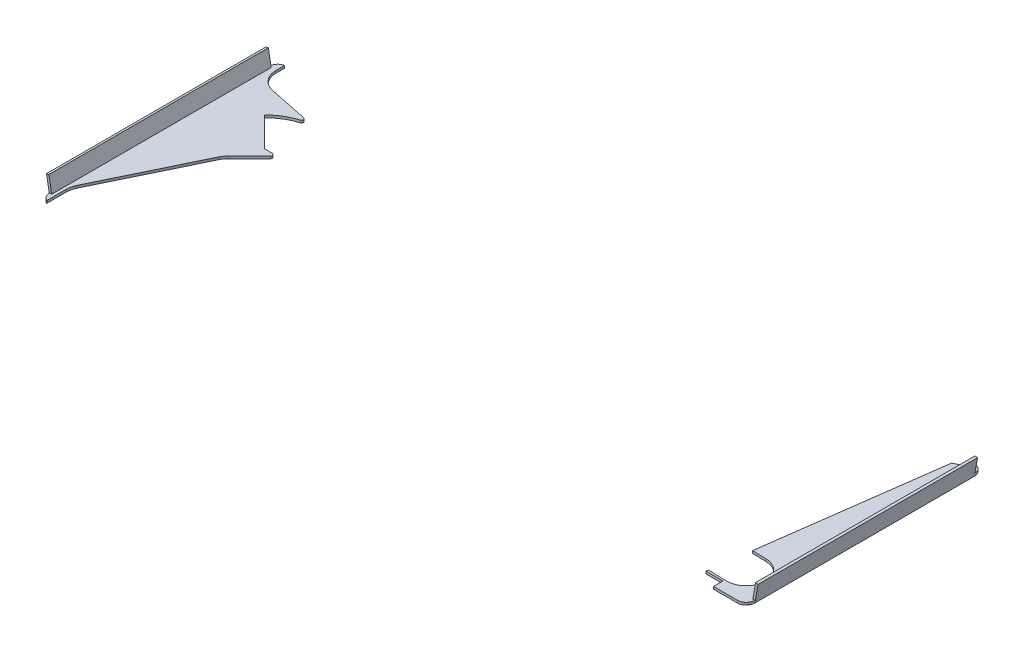
from build123d import *

# Parameters (mm, degrees)
BOSS_EXTRUDE1_DEPTH   = 6.35
BOSS_EXTRUDE1_2_DEPTH = 6.35
SKETCH2_W             = 571.5
SKETCH2_H             = 46.788217492
BOSS_EXTRUDE2_DEPTH   = 6.35
SKETCH3_W             = 571.5
SKETCH3_H             = 46.788217492
BOSS_EXTRUDE3_DEPTH   = 6.35


with BuildPart() as part:
    # Sketch1 → Boss-Extrude1 (new body)
    with BuildSketch(Plane(origin=(0, 0, 0), x_dir=(1, 0, 0), z_dir=(0, 1, 0))):
        with BuildLine():
            Line((918.085858671, -285.75), (918.085858671, 285.75))
            ThreePointArc((918.085858671, 285.75), (911.426679842, 301.826679842), (895.35, 308.485858671))
            Line((895.35, 308.485858671), (885.19, 308.485858671))
            Line((885.19, 308.485858671), (885.19, 289.56))
            Line((885.19, 289.56), (864.87, 279.4))
            Line((864.87, 279.4), (803.148852568, -176.858594457))
            Line((803.148852568, -176.858594457), (839.587388975, -177.854835662))
            ThreePointArc((839.587388975, -177.854835662), (888.945151826, -229.987846529), (836.811695918, -279.34513931))
            Line((836.811695918, -279.34513931), (789.460059122, -278.049675912))
            Line((789.460059122, -278.049675912), (788.67, -283.889996122))
            Line((788.67, -283.889996122), (833.12, -283.889996122))
            Line((833.12, -283.889996122), (833.12, -308.485858671))
            Line((833.12, -308.485858671), (895.35, -308.485858671))
            ThreePointArc((895.35, -308.485858671), (911.426679842, -301.826679842), (918.085858671, -285.75))
        make_face()
    extrude(amount=BOSS_EXTRUDE1_DEPTH)

    # Sketch3 → Boss-Extrude3 (add)
    with BuildSketch(Plane(origin=(890.402182656, -157.001928484, 0), x_dir=(0, 0, 1), z_dir=(-0.9848077530122081, 0.17364817766693072, 0))):
        with Locations((0, 182.818045046)):
            Rectangle(SKETCH3_W, SKETCH3_H)
    extrude(amount=BOSS_EXTRUDE3_DEPTH)


with BuildPart() as body_2:
    # Sketch1 → Boss-Extrude1 2 (new body)
    with BuildSketch(Plane(origin=(0, 0, 0), x_dir=(1, 0, 0), z_dir=(0, 1, 0))):
        with BuildLine():
            Line((-918.085858671, 285.75), (-918.085858671, -285.75))
            ThreePointArc((-918.085858671, -285.75), (-914.511728847, -297.987132715), (-904.913062406, -306.376854024))
            Line((-904.913062406, -306.376854024), (-904.913062406, -255.27))
            ThreePointArc((-904.913062406, -255.27), (-903.629350189, -243.921993823), (-899.843092163, -233.147514188))
            Line((-899.843092163, -233.147514188), (-779.193092163, 16.251587569))
            ThreePointArc((-779.193092163, 16.251587569), (-774.867453261, 23.562355365), (-769.384086891, 30.050126241))
            Line((-769.384086891, 30.050126241), (-714.14942221, 85.284790922))
            ThreePointArc((-714.14942221, 85.284790922), (-713.065558454, 90.733741989), (-717.684956116, 93.820324827))
            Line((-717.684956116, 93.820324827), (-737.683726269, 93.820324827))
            Line((-737.683726269, 93.820324827), (-813.980179417, 170.116777976))
            ThreePointArc((-813.980179417, 170.116777976), (-787.570356374, 191.280977084), (-756.640276937, 205.018963219))
            ThreePointArc((-756.640276937, 205.018963219), (-753.070575733, 210.021070937), (-757.046996385, 214.706359307))
            Line((-757.046996385, 214.706359307), (-859.397945134, 236.016540238))
            ThreePointArc((-859.397945134, 236.016540238), (-888.455441312, 253.698373918), (-899.843092163, 285.75))
            Line((-899.843092163, 285.75), (-899.843092163, 308.037471645))
            ThreePointArc((-899.843092163, 308.037471645), (-912.943657634, 300.150780554), (-918.085858671, 285.75))
        make_face()
    extrude(amount=BOSS_EXTRUDE1_2_DEPTH)

    # Sketch2 → Boss-Extrude2 (add)
    with BuildSketch(Plane(origin=(-890.402182656, -157.001928484, 0), x_dir=(0, 0, -1), z_dir=(0.9848077530122081, 0.17364817766693072, 0))):
        with Locations((0, 182.818045046)):
            Rectangle(SKETCH2_W, SKETCH2_H)
    extrude(amount=BOSS_EXTRUDE2_DEPTH)


solid = Compound([part.part, body_2.part])
